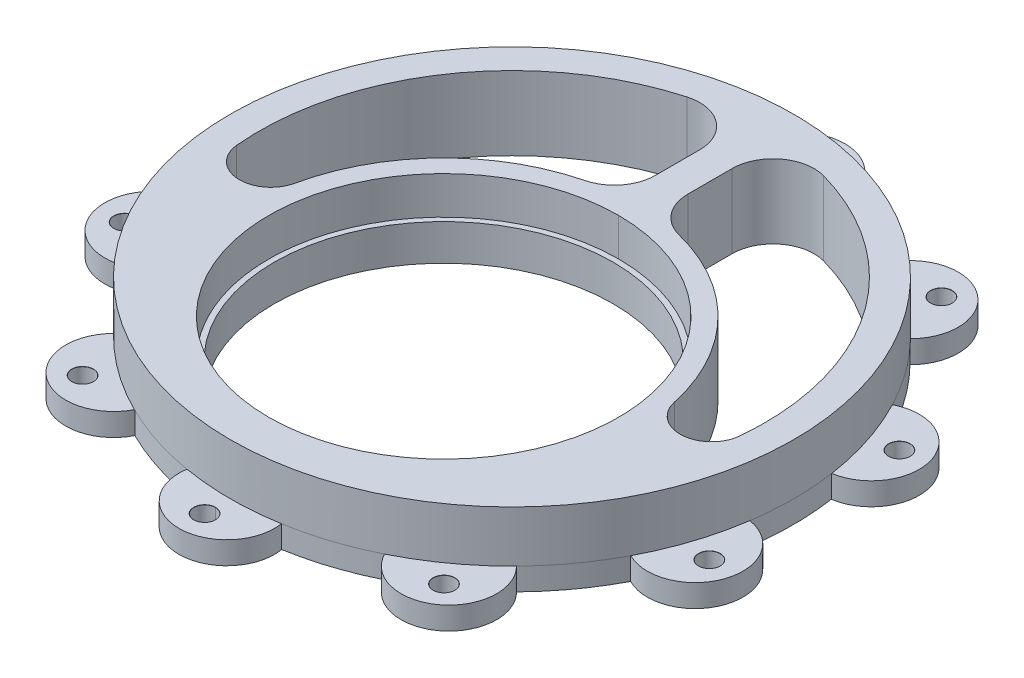
from build123d import *

# Parameters (mm, degrees)
SKETCH1_R                  = 61.9125
SKETCH1_R_2                = 30.988
SLOTTED_BODY_EXTRUDE_DEPTH = 4.191
SKETCH5_R                  = 52.3875
BOSS_EXTRUDE3_DEPTH        = 9.525
SKETCH6_R                  = 32.512
CUT_EXTRUDE5_DEPTH         = 89.62530095
SKETCH8_R                  = 32.512
SKETCH8_R_2                = 31.496
BOSS_EXTRUDE4_DEPTH        = 6.700000062
CIRPATTERN1_COUNT          = 10
CUT_EXTRUDE9_DEPTH         = 89.074065067
CIRPATTERN6_COUNT          = 10


with BuildPart() as part:
    # Sketch1 → Slotted-Body Extrude (new body)
    with BuildSketch(Plane(origin=(0, 0, 0), x_dir=(1, 0, 0), z_dir=(0, 1, 0))):
        with Locations(Location((0, 0, 0), (0, 0, 270))):
            Circle(SKETCH1_R)
        with Locations(Location((0, -12.7, 0), (0, 0, 270))):
            Circle(SKETCH1_R_2, mode=Mode.SUBTRACT)
    extrude(amount=SLOTTED_BODY_EXTRUDE_DEPTH)

    # Sketch5 → Boss-Extrude3 (add)
    with BuildSketch(Plane(origin=(0, 4.191, 0), x_dir=(1, 0, 0), z_dir=(0, 1, 0))):
        with Locations(Location((0, 0, 0), (0, 0, 90))):
            Circle(SKETCH5_R)
    extrude(amount=BOSS_EXTRUDE3_DEPTH)

    # Sketch6 → Cut-Extrude5 (cut, through all)
    with BuildSketch(Plane.XZ):
        with Locations(Location((0, 12.7, 0), (0, 0, 270))):
            Circle(SKETCH6_R)
        with BuildLine():
            Line((3.013951015, -37.906674687), (3.013951015, -29.674053734))
            ThreePointArc((3.013951015, -29.674053734), (4.62572071, -24.987309811), (8.779192117, -22.283230408))
            ThreePointArc((8.779192117, -22.283230408), (25.925135322, -12.375645206), (35.256203169, 5.09074497))
            ThreePointArc((35.256203169, 5.09074497), (41.313127715, 9.689980346), (46.782976949, 4.406037654))
            ThreePointArc((46.782976949, 4.406037654), (38.737451576, -26.59830719), (12.692135082, -45.243450433))
            ThreePointArc((12.692135082, -45.243450433), (6.03063496, -43.979061474), (3.013951015, -37.906674687))
        make_face()
        with BuildLine():
            Line((-3.013951015, -37.906674687), (-3.013951015, -29.674053734))
            ThreePointArc((-3.013951015, -29.674053734), (-4.62572071, -24.987309811), (-8.779192117, -22.283230408))
            ThreePointArc((-8.779192117, -22.283230408), (-25.925135322, -12.375645206), (-35.256203169, 5.09074497))
            ThreePointArc((-35.256203169, 5.09074497), (-41.313127715, 9.689980346), (-46.782976949, 4.406037654))
            ThreePointArc((-46.782976949, 4.406037654), (-38.737451576, -26.59830719), (-12.692135082, -45.243450433))
            ThreePointArc((-12.692135082, -45.243450433), (-6.03063496, -43.979061474), (-3.013951015, -37.906674687))
        make_face()
    extrude(amount=-CUT_EXTRUDE5_DEPTH, mode=Mode.SUBTRACT)

    # Sketch10 → Ø4.0mm Dowel Hole2 (revolve, cut)
    with BuildSketch(Plane(origin=(0, 4.191, -57.15), x_dir=(0, 0, 1), z_dir=(1, 0, 0))):
        Polygon((0, 0), (0, 4.191), (2, 4.191), (2, 0.025), (2.025, 0), align=None)
    f_4_0mm_dowel_hole2 = revolve(axis=Axis((0, 10.541, -57.15), (0, -1, 0)), mode=Mode.SUBTRACT)

    # CirPattern1: Ø4.0mm Dowel Hole2 ×10 about axis
    cirpattern1_axis = Axis((0, 0, 0), (0, 1, 0))
    for i in range(1, CIRPATTERN1_COUNT):
        add(f_4_0mm_dowel_hole2.rotate(cirpattern1_axis, i * 360 / CIRPATTERN1_COUNT), mode=Mode.SUBTRACT)

    # Sketch15 → Cut-Extrude9 (cut, through all)
    with BuildSketch(Plane(origin=(0, 4.191, 0), x_dir=(1, 0, 0), z_dir=(0, 1, 0))):
        with BuildLine():
            ThreePointArc((-23.222629114, 46.888276499), (-29.066654393, 51.534709081), (-36.391254433, 50.088264664))
            ThreePointArc((-36.391254433, 50.088264664), (-19.132014664, 58.882286565), (0, 61.9125))
            ThreePointArc((0, 61.9125), (-6.775924606, 58.777406232), (-8.772735825, 51.583331437))
            ThreePointArc((-8.772735825, 51.583331437), (-16.169005214, 49.763081159), (-23.222629114, 46.888276499))
        make_face()
    cut_extrude9 = extrude(amount=-CUT_EXTRUDE9_DEPTH, mode=Mode.SUBTRACT)

    # CirPattern6: Cut-Extrude9 ×10 about axis
    cirpattern6_axis = Axis((0, 0, 0), (0, 1, 0))
    for i in range(1, CIRPATTERN6_COUNT):
        add(cut_extrude9.rotate(cirpattern6_axis, i * 360 / CIRPATTERN6_COUNT), mode=Mode.SUBTRACT)


with BuildPart() as body_2:
    # Sketch8 → Boss-Extrude4 (new body)
    with BuildSketch(Plane.XZ):
        with Locations(Location((0, 12.7, 0), (0, 0, 270))):
            Circle(SKETCH8_R)
        with Locations(Location((0, 12.7, 0), (0, 0, 270))):
            Circle(SKETCH8_R_2, mode=Mode.SUBTRACT)
    extrude(amount=-BOSS_EXTRUDE4_DEPTH)


solid = Compound([part.part, body_2.part])
